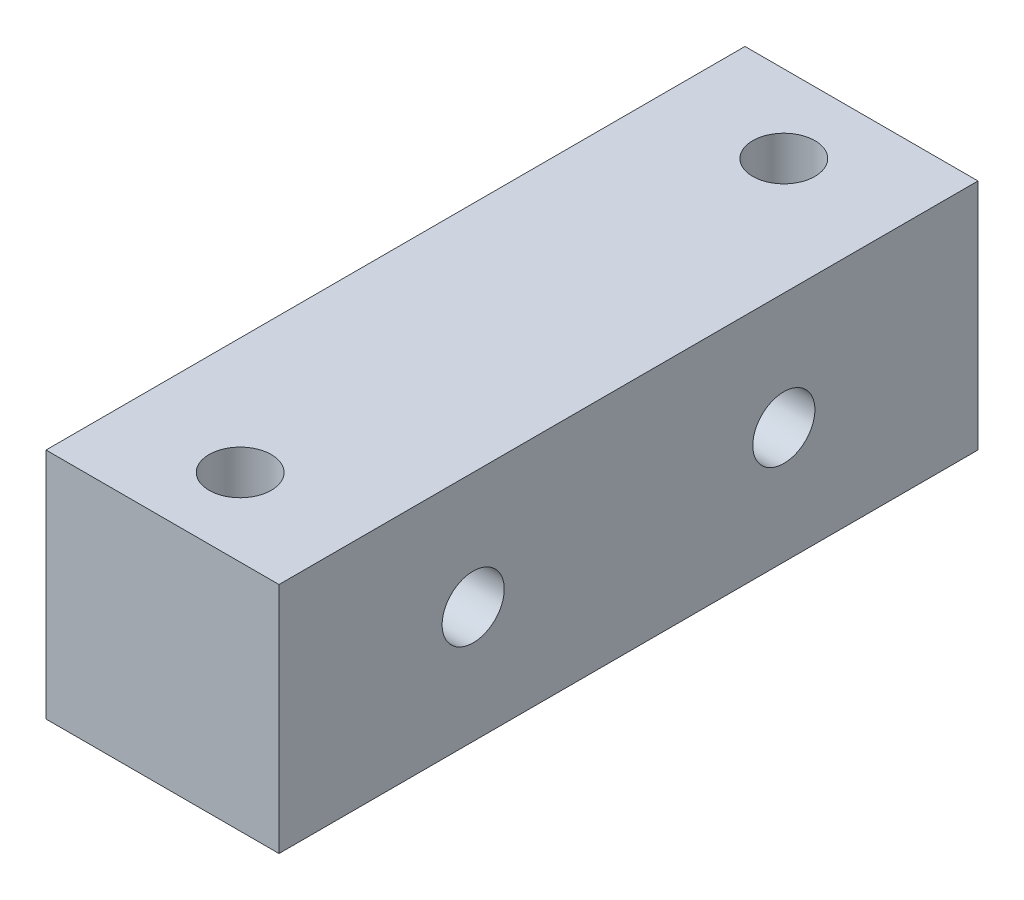
from build123d import *

# Parameters (mm, degrees)
SKETCH1_W           = 30
SKETCH1_H           = 90
BOSS_EXTRUDE1_DEPTH = 30
SKETCH2_R           = 4
CUT_EXTRUDE1_DEPTH  = 62.846584384
SKETCH3_R           = 4
CUT_EXTRUDE2_DEPTH  = 57.124860802


with BuildPart() as part:
    # Sketch1 → Boss-Extrude1 (new body)
    with BuildSketch(Plane(origin=(0, 0, 0), x_dir=(1, 0, 0), z_dir=(0, 1, 0))):
        Rectangle(SKETCH1_W, SKETCH1_H)
    extrude(amount=BOSS_EXTRUDE1_DEPTH)

    # Sketch2 → Cut-Extrude1 (cut, through all)
    with BuildSketch(Plane.ZY.offset(15)):
        with Locations((-20, 15)):
            Circle(SKETCH2_R)
        with Locations((20, 15)):
            Circle(SKETCH2_R)
    extrude(amount=-CUT_EXTRUDE1_DEPTH, mode=Mode.SUBTRACT)

    # Sketch3 → Cut-Extrude2 (cut, through all)
    with BuildSketch(Plane(origin=(0, 30, 0), x_dir=(1, 0, 0), z_dir=(0, 1, 0))):
        with Locations(Location((0, 35, 0), (0, 0, 270))):
            Circle(SKETCH3_R)
        with Locations(Location((0, -35, 0), (0, 0, 90))):
            Circle(SKETCH3_R)
    extrude(amount=-CUT_EXTRUDE2_DEPTH, mode=Mode.SUBTRACT)


solid = part.part
